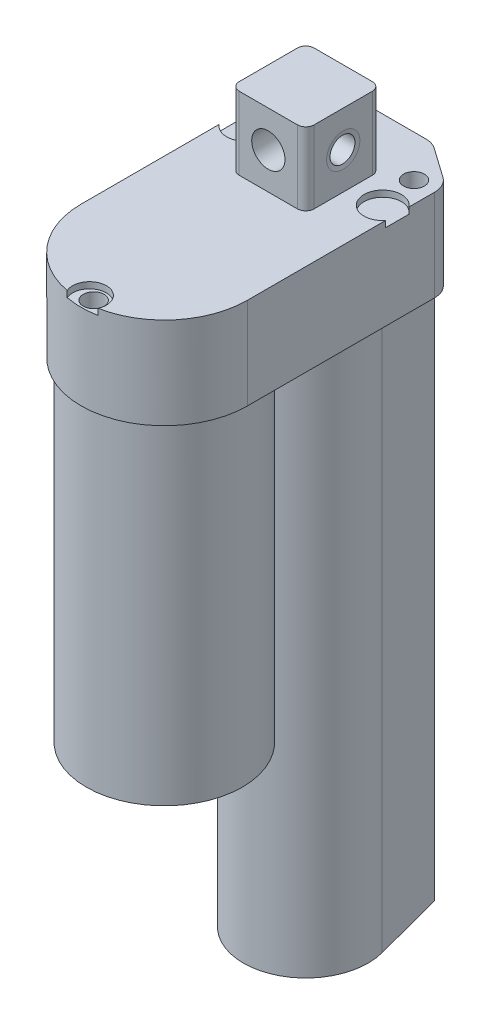
from build123d import *

# Parameters (mm, degrees)
SALIENTE_EXTRUIR1_DEPTH  = 22
CROQUIS3_R               = 2.5
CROQUIS3_R_2             = 4.5
CORTAR_EXTRUIR2_DEPTH    = 1.5
CROQUIS4_R               = 2.5
CORTAR_EXTRUIR3_DEPTH    = 18
CROQUIS5_R               = 4.05861195
CORTAR_EXTRUIR4_DEPTH    = 1.5
CROQUIS6_R               = 2.5
CORTAR_EXTRUIR5_DEPTH    = 15
SALIENTE_EXTRUIR2_DEPTH  = 19
CROQUIS8_R               = 3
CORTAR_EXTRUIR7_DEPTH    = 19
CROQUIS9_R               = 4
CORTAR_EXTRUIR10_DEPTH   = 0.5
CORTAR_EXTRUIR10_DRAFT   = -80
CROQUIS10_R              = 4
CORTAR_EXTRUIR11_DEPTH   = 0.5
CORTAR_EXTRUIR11_DRAFT   = -80
SALIENTE_EXTRUIR3_DEPTH  = 135.5
CROQUIS12_R              = 10
CORTAR_EXTRUIR12_DEPTH   = 100
CROQUIS15_R              = 18.75
SALIENTE_EXTRUIR10_DEPTH = 80
CROQUIS16_R              = 4
CORTAR_EXTRUIR13_DEPTH   = 151.762230018


with BuildPart() as part:
    # Croquis2 → Saliente-Extruir1 (new body)
    with BuildSketch(Plane(origin=(0, 0, 0), x_dir=(1, 0, 0), z_dir=(0, 1, 0))):
        with BuildLine():
            Line((-17.878262929, 49.088471905), (-10.775937662, 54.088471905))
            ThreePointArc((-10.775937662, 54.088471905), (-9.407250911, 54.766673868), (-7.897674733, 55))
            Line((-7.897674733, 55), (7.897674733, 55))
            ThreePointArc((7.897674733, 55), (9.407250911, 54.766673868), (10.775937662, 54.088471905))
            Line((10.775937662, 54.088471905), (17.878262929, 49.088471905))
            ThreePointArc((17.878262929, 49.088471905), (19.437978968, 47.303115863), (20, 45))
            Line((20, 45), (20, 0))
            ThreePointArc((20, 0), (0, -20), (-20, 0))
            Line((-20, 0), (-20, 45))
            ThreePointArc((-20, 45), (-19.437978968, 47.303115863), (-17.878262929, 49.088471905))
        make_face()
    extrude(amount=SALIENTE_EXTRUIR1_DEPTH)

    # Croquis3 → Cortar-Extruir2 (cut)
    with BuildSketch(Plane(origin=(0, 22, 0), x_dir=(1, 0, 0), z_dir=(0, 1, 0))):
        with Locations(Location((-15, 45, 0), (0, 0, 270))):
            Circle(CROQUIS3_R)
        with Locations(Location((15, 45, 0), (0, 0, 270))):
            Circle(CROQUIS3_R)
        with Locations((-16.5, 36)):
            Circle(CROQUIS3_R_2)
        with Locations((16.5, 36)):
            Circle(CROQUIS3_R_2)
    extrude(amount=-CORTAR_EXTRUIR2_DEPTH, mode=Mode.SUBTRACT)

    # Croquis4 → Cortar-Extruir3 (cut)
    with BuildSketch(Plane(origin=(0, 22, 0), x_dir=(1, 0, 0), z_dir=(0, 1, 0))):
        with Locations(Location((-15, 45, 0), (0, 0, 270))):
            Circle(CROQUIS4_R)
        with Locations(Location((15, 45, 0), (0, 0, 270))):
            Circle(CROQUIS4_R)
    extrude(amount=-CORTAR_EXTRUIR3_DEPTH, mode=Mode.SUBTRACT)

    # Croquis5 → Cortar-Extruir4 (cut)
    with BuildSketch(Plane(origin=(0, 22, 0), x_dir=(1, 0, 0), z_dir=(0, 1, 0))):
        with Locations((0.022007055, -18)):
            Circle(CROQUIS5_R)
    extrude(amount=-CORTAR_EXTRUIR4_DEPTH, mode=Mode.SUBTRACT)

    # Croquis6 → Cortar-Extruir5 (cut)
    with BuildSketch(Plane(origin=(0, 20.5, 0), x_dir=(1, 0, 0), z_dir=(0, 1, 0))):
        with Locations(Location((0.024452265, -16.999985052, 0), (0, 0, 270))):
            Circle(CROQUIS6_R)
    extrude(amount=-CORTAR_EXTRUIR5_DEPTH, mode=Mode.SUBTRACT)

    # Croquis7 → Saliente-Extruir2 (add)
    with BuildSketch(Plane(origin=(0, 20.5, 0), x_dir=(1, 0, 0), z_dir=(0, 1, 0))):
        with BuildLine():
            Line((7, 25), (-7, 25))
            ThreePointArc((-7, 25), (-8.414213562, 25.585786438), (-9, 27))
            Line((-9, 27), (-9, 41))
            ThreePointArc((-9, 41), (-8.414213562, 42.414213562), (-7, 43))
            Line((-7, 43), (7, 43))
            ThreePointArc((7, 43), (8.414213562, 42.414213562), (9, 41))
            Line((9, 41), (9, 27))
            ThreePointArc((9, 27), (8.414213562, 25.585786438), (7, 25))
        make_face()
    extrude(amount=SALIENTE_EXTRUIR2_DEPTH)

    # Croquis8 → Cortar-Extruir7 (cut)
    with BuildSketch(Plane.ZY.offset(9)):
        with Locations((-34, 30.75)):
            Circle(CROQUIS8_R)
    extrude(amount=-CORTAR_EXTRUIR7_DEPTH, mode=Mode.SUBTRACT)


with BuildPart() as cortar_extruir10_tool:
    # Croquis9 → Cortar-Extruir10 (with draft: the straight prism first)
    with BuildSketch(Plane.ZY.offset(9)):
        with Locations((-34, 30.75)):
            Circle(CROQUIS9_R)
    extrude(amount=-CORTAR_EXTRUIR10_DEPTH)
    # Cortar-Extruir10: the draft: its side faces are tilted about the plane it starts from
    cortar_extruir10_sides = [cortar_extruir10_tool.faces().sort_by_distance(p)[0] for p in [
        (-8.75, 30.75, -38),
    ]]
    draft(cortar_extruir10_sides, Plane.ZY.offset(9), CORTAR_EXTRUIR10_DRAFT)


with BuildPart() as part_1:
    add(part.part)

    # Cortar-Extruir10: cut by cortar_extruir10_tool
    add(cortar_extruir10_tool.part, mode=Mode.SUBTRACT)


with BuildPart() as cortar_extruir11_tool:
    # Croquis10 → Cortar-Extruir11 (with draft: the straight prism first)
    with BuildSketch(Plane(origin=(9, 0, 0), x_dir=(0, 0, -1), z_dir=(1, 0, 0))):
        with Locations((34, 30.75)):
            Circle(CROQUIS10_R)
    extrude(amount=-CORTAR_EXTRUIR11_DEPTH)
    # Cortar-Extruir11: the draft: its side faces are tilted about the plane it starts from
    cortar_extruir11_sides = [cortar_extruir11_tool.faces().sort_by_distance(p)[0] for p in [
        (8.75, 30.75, -30),
    ]]
    draft(cortar_extruir11_sides, Plane(origin=(9, 0, 0), x_dir=(0, 0, -1), z_dir=(1, 0, 0)), CORTAR_EXTRUIR11_DRAFT)


with BuildPart() as part_2:
    add(part_1.part)

    # Cortar-Extruir11: cut by cortar_extruir11_tool
    add(cortar_extruir11_tool.part, mode=Mode.SUBTRACT)

    # Croquis11 → Saliente-Extruir3 (add)
    with BuildSketch(Plane.XZ):
        with BuildLine():
            Line((-10, -55), (-14.509357639, -37.805067791))
            ThreePointArc((-14.509357639, -37.805067791), (0, -19), (14.509357639, -37.805067791))
            Line((14.509357639, -37.805067791), (10, -55))
            Line((10, -55), (-10, -55))
        make_face()
    extrude(amount=SALIENTE_EXTRUIR3_DEPTH)

    # Croquis12 → Cortar-Extruir12 (cut)
    with BuildSketch(Plane.XZ.offset(135.5)):
        with Locations(Location((0, -34, 0), (0, 0, 270))):
            Circle(CROQUIS12_R)
    extrude(amount=-CORTAR_EXTRUIR12_DEPTH, mode=Mode.SUBTRACT)

    # Croquis15 → Saliente-Extruir10 (add)
    with BuildSketch(Plane.XZ):
        with Locations(Location((0, 0, 0), (0, 0, 90))):
            Circle(CROQUIS15_R)
    extrude(amount=SALIENTE_EXTRUIR10_DEPTH)

    # Croquis16 → Cortar-Extruir13 (cut, through all)
    with BuildSketch(Plane(origin=(0, 0, -43), x_dir=(-1, 0, 0), z_dir=(0, 0, -1))):
        with Locations((0, 30.75)):
            Circle(CROQUIS16_R)
    extrude(amount=-CORTAR_EXTRUIR13_DEPTH, mode=Mode.SUBTRACT)


solid = part_2.part
